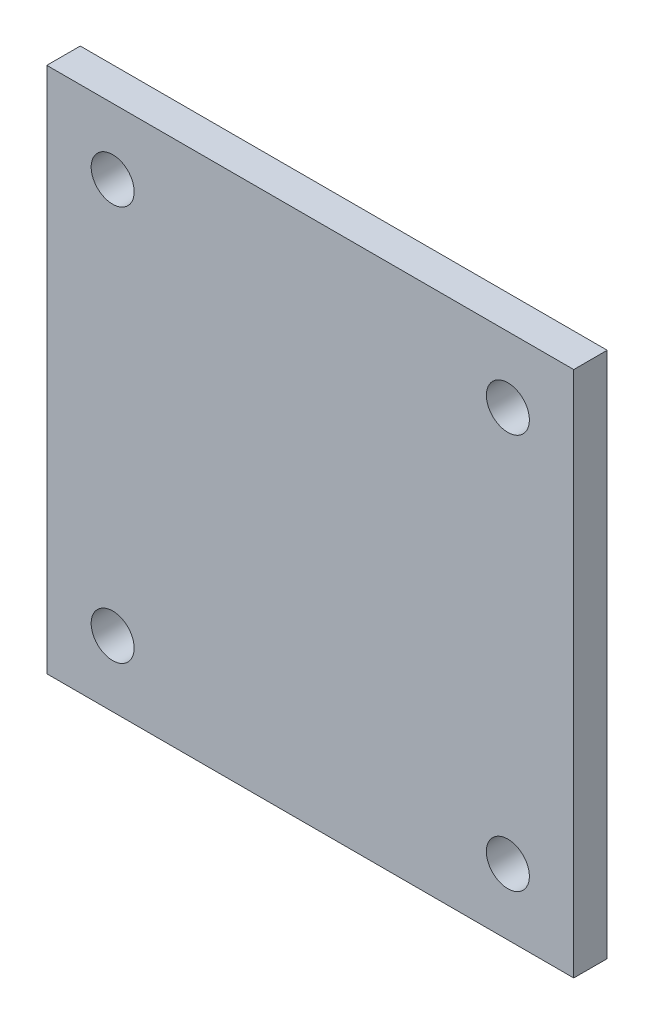
from build123d import *

# Parameters (mm, degrees)
SKETCH1_W             = 40
SKETCH1_H             = 40
BOSS_EXTRUDE1_DEPTH   = 2.54
F_4_CLEARANCE_HOLE1_D = 3.2639


with BuildPart() as part:
    # Sketch1 → Boss-Extrude1 (new body)
    with BuildSketch(Plane.XY):
        Rectangle(SKETCH1_W, SKETCH1_H)
    extrude(amount=BOSS_EXTRUDE1_DEPTH)

    # #4 Clearance Hole1 (through all)
    with Locations(Plane.XY.offset(2.54)):
        with Locations((-15, 15), (15, 15), (15, -15), (-15, -15)):
            Hole(F_4_CLEARANCE_HOLE1_D / 2)


solid = part.part
